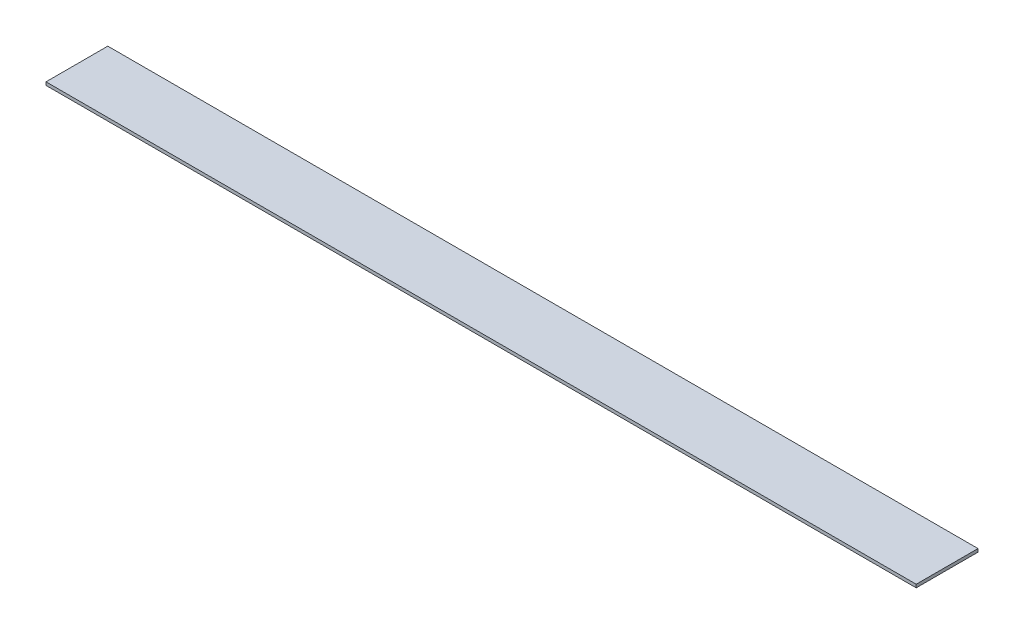
from build123d import *

# Parameters (mm, degrees)
SKETCH_1_W      = 138
SKETCH_1_H      = 9.8
EXTRUDE_1_DEPTH = 0.5


with BuildPart() as part:
    # Эскиз1 → Бобышка-Вытянуть1 (new body)
    with BuildSketch(Plane(origin=(0, 0, 0), x_dir=(1, 0, 0), z_dir=(0, 1, 0))):
        with Locations((69, 4.9)):
            Rectangle(SKETCH_1_W, SKETCH_1_H)
    extrude(amount=EXTRUDE_1_DEPTH)


solid = part.part
